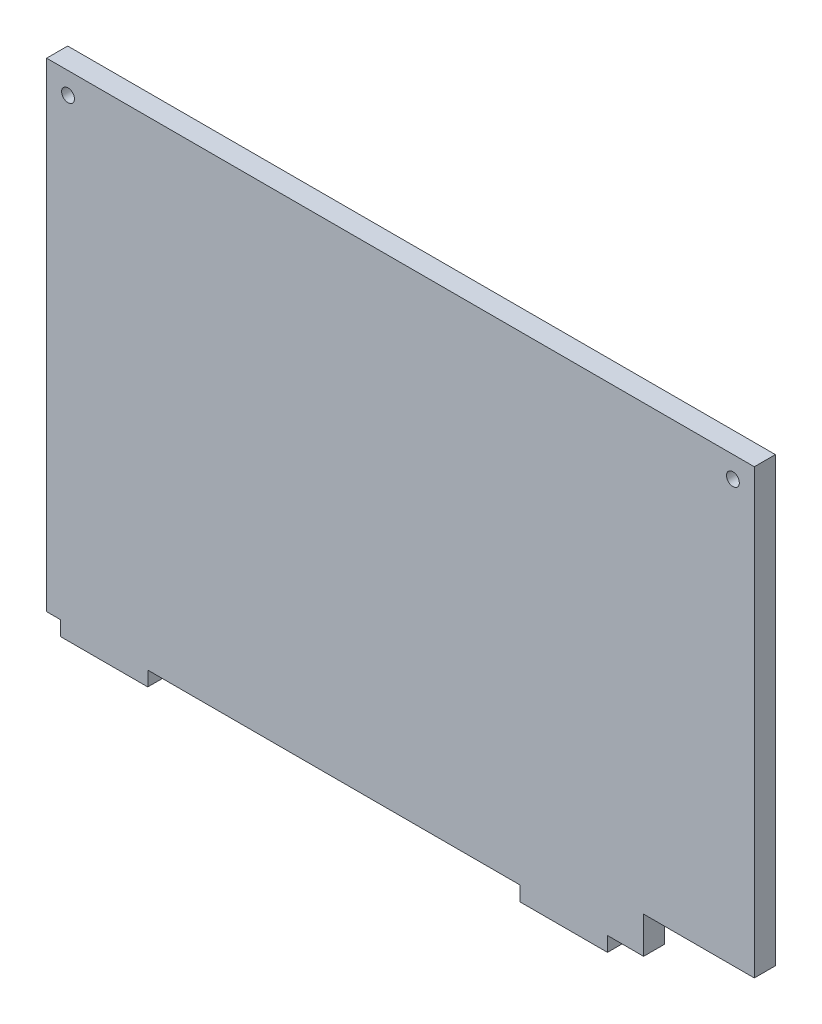
from build123d import *

# Parameters (mm, degrees)
BOSS_EXTRUDE1_DEPTH                             = 5.9
MOVE_FACE1_BY                                   = 6.3
CSK_FOR_M3_FLAT_HEAD_MACHINE_SCREW2_D           = 3.6
CSK_FOR_M3_FLAT_HEAD_MACHINE_SCREW2_CSINK_D     = 6.3
CSK_FOR_M3_FLAT_HEAD_MACHINE_SCREW2_CSINK_ANGLE = 90


with BuildPart() as part:
    # Sketch1 → Boss-Extrude1 (new body)
    with BuildSketch(Plane.XY):
        Polygon((0, 0), (10.125, 0), (10.125, -4.1), (34.625, -4.1), (34.625, 0), (138.875, 0), (138.875, -4.1), (163.375, -4.1), (163.375, 0), (173.5, 0), (173.5, 10.25), (204.5, 10.25), (204.5, 134.25), (0, 134.25), align=None)
    extrude(amount=BOSS_EXTRUDE1_DEPTH)

    # Move Face1: a face moved inward by 6.3
    extrude(part.faces().sort_by_distance((0, 67.125, 2.95))[0], amount=MOVE_FACE1_BY, dir=(1, 0, 0), mode=Mode.SUBTRACT)

    # CSK for M3 Flat Head Machine Screw2 (through all)
    with Locations(Plane(origin=(0, 0, 0), x_dir=(-1, 0, 0), z_dir=(0, 0, -1))):
        with Locations((-198.5, 128.25), (-12.3, 128.25)):
            CounterSinkHole(CSK_FOR_M3_FLAT_HEAD_MACHINE_SCREW2_D / 2, CSK_FOR_M3_FLAT_HEAD_MACHINE_SCREW2_CSINK_D / 2, counter_sink_angle=CSK_FOR_M3_FLAT_HEAD_MACHINE_SCREW2_CSINK_ANGLE)


solid = part.part
